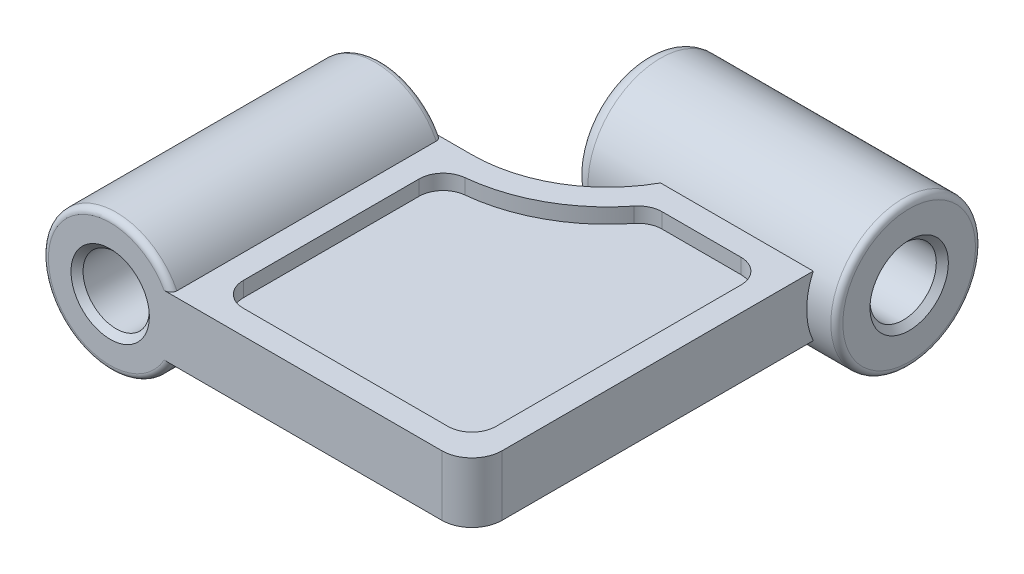
from build123d import *

# Parameters (mm, degrees)
BOSS_EXTRUDE1_DEPTH = 10
SKETCH2_R           = 22.5
BOSS_EXTRUDE2_DEPTH = 90
SKETCH3_R           = 11
CUT_EXTRUDE1_DEPTH  = 164.802472509
BOSS_EXTRUDE3_START = 10
SKETCH4_R           = 24
BOSS_EXTRUDE3_DEPTH = 87.5
SKETCH5_R           = 11
CUT_EXTRUDE2_DEPTH  = 206.078643463
CUT_EXTRUDE3_DEPTH  = 5
FILLET1_R           = 10
FILLET2_R           = 5
FILLET3_R           = 2
CHAMFER1_SIZE       = 2


with BuildPart() as part:
    # Sketch1 → Boss-Extrude1 (new, symmetric)
    with BuildSketch(Plane(origin=(0, 0, 0), x_dir=(1, 0, 0), z_dir=(0, 1, 0))):
        with BuildLine():
            ThreePointArc((45, 0), (31.819805153, -31.819805153), (0, -45))
            Line((0, -45), (-45, -45))
            Line((-45, -45), (-45, -135))
            Line((-45, -135), (90, -135))
            Line((90, -135), (90, 0))
            Line((90, 0), (45, 0))
        make_face()
    extrude(amount=BOSS_EXTRUDE1_DEPTH, both=True)

    # Sketch2 → Boss-Extrude2 (add)
    with BuildSketch(Plane.XY.offset(135)):
        with Locations((-30, 0)):
            Circle(SKETCH2_R)
    extrude(amount=-BOSS_EXTRUDE2_DEPTH)

    # Sketch3 → Cut-Extrude1 (cut, through all)
    with BuildSketch(Plane.XY.offset(135)):
        with Locations((-30, 0)):
            Circle(SKETCH3_R)
    extrude(amount=-CUT_EXTRUDE1_DEPTH, mode=Mode.SUBTRACT)

    # Sketch4 → Boss-Extrude3 (add)
    with BuildSketch(Plane(origin=(90, 0, 0), x_dir=(0, 0, -1), z_dir=(1, 0, 0)).offset(BOSS_EXTRUDE3_START)):
        Circle(SKETCH4_R)
    extrude(amount=-BOSS_EXTRUDE3_DEPTH)

    # Sketch5 → Cut-Extrude2 (cut, through all)
    with BuildSketch(Plane(origin=(100, 0, 0), x_dir=(0, 0, -1), z_dir=(1, 0, 0))):
        Circle(SKETCH5_R)
    extrude(amount=-CUT_EXTRUDE2_DEPTH, mode=Mode.SUBTRACT)

    # Sketch6 → Cut-Extrude3 (cut)
    with BuildSketch(Plane(origin=(0, 10, 0), x_dir=(1, 0, 0), z_dir=(0, 1, 0))):
        with BuildLine():
            Line((74, -29.817424229), (47.862745687, -29.817424229))
            ThreePointArc((47.862745687, -29.817424229), (44.375432792, -30.617518065), (41.585664285, -32.857762035))
            ThreePointArc((41.585664285, -32.857762035), (25.48374719, -46.471266705), (5.348346748, -52.729452748))
            ThreePointArc((5.348346748, -52.729452748), (0.220226063, -55.324772633), (-1.844355629, -60.688615426))
            Line((-1.844355629, -60.688615426), (-1.844355629, -119))
            ThreePointArc((-1.844355629, -119), (0.498790121, -124.656854249), (6.155644371, -127))
            Line((6.155644371, -127), (74, -127))
            ThreePointArc((74, -127), (79.656854249, -124.656854249), (82, -119))
            Line((82, -119), (82, -37.817424229))
            ThreePointArc((82, -37.817424229), (79.656854249, -32.16056998), (74, -29.817424229))
        make_face()
    cut_extrude3 = extrude(amount=-CUT_EXTRUDE3_DEPTH, mode=Mode.SUBTRACT)

    # Mirror1: Cut-Extrude3 across plane
    add(cut_extrude3.mirror(Plane.ZX), mode=Mode.SUBTRACT)

    # Fillet1
    fillet1_edges = [part.edges().sort_by_distance(p)[0] for p in [
        (90, 0, 135),
    ]]
    fillet(fillet1_edges, radius=FILLET1_R)

    # Fillet2
    fillet2_edges = [part.edges().sort_by_distance(p)[0] for p in [
        (12.5, 0, 24),
    ]]
    fillet(fillet2_edges, radius=FILLET2_R)

    # Fillet3
    fillet3_edges = [part.edges().sort_by_distance(p)[0] for p in [
        (-52.5, 0, 45),
        (-52.5, 0, 135),
        (100, 0, 24),
    ]]
    fillet(fillet3_edges, radius=FILLET3_R)

    # Chamfer1
    chamfer1_edges = [part.edges().sort_by_distance(p)[0] for p in [
        (-41, 0, 45),
        (-41, 0, 135),
        (12.5, 0, 11),
        (100, 0, 11),
    ]]
    chamfer(chamfer1_edges, length=CHAMFER1_SIZE)


solid = part.part
